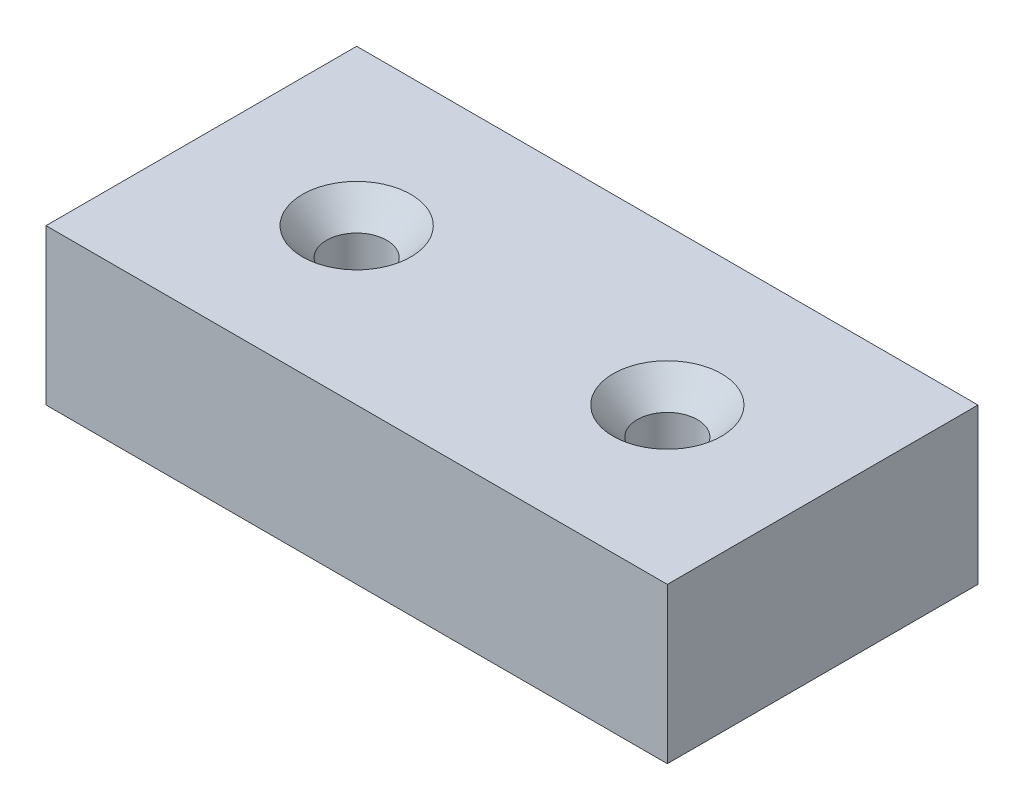
from build123d import *
from OCP.BRepFilletAPI import BRepFilletAPI_MakeChamfer

# Parameters (mm, degrees)
SKETCH1_W           = 50.8
SKETCH1_H           = 25.4
BOSS_EXTRUDE1_DEPTH = 12.7
HOLE1_D             = 4.9276
CHAMFER1_SIZE       = 1.9685
CHAMFER1_SIZE2      = 2.264500221


with BuildPart() as part:
    # Sketch1 → Boss-Extrude1 (new body)
    with BuildSketch(Plane(origin=(0, 6.35, 0), x_dir=(1, 0, 0), z_dir=(0, 1, 0))):
        Rectangle(SKETCH1_W, SKETCH1_H)
    extrude(amount=-BOSS_EXTRUDE1_DEPTH)

    # Hole1 (through all)
    with Locations(Plane(origin=(0, 6.35, 0), x_dir=(1, 0, 0), z_dir=(0, 1, 0))):
        with Locations((-12.7, 0), (12.7, 0)):
            Hole(HOLE1_D / 2)

    # Chamfer1: one chamfer whose edges measure the first distance from different faces: ONE call of the kernel's chamfer builder (chamfer() names one face for all edges)
    chamfer1_edges_1 = [part.edges().sort_by_distance(p)[0] for p in [
        (15.1638, 6.35, 0),
        (-10.2362, 6.35, 0),
    ]]
    chamfer1_side_1 = [part.faces().sort_by_distance(p)[0] for p in [
        (0, 6.35, 0),
    ]]
    chamfer1_edges_2 = [part.edges().sort_by_distance(p)[0] for p in [
        (15.1638, -6.35, 0),
    ]]
    chamfer1_side_2 = [part.faces().sort_by_distance(p)[0] for p in [
        (15.1638, 0, 0),
    ]]
    chamfer1_edges_3 = [part.edges().sort_by_distance(p)[0] for p in [
        (-10.2362, -6.35, 0),
    ]]
    chamfer1_side_3 = [part.faces().sort_by_distance(p)[0] for p in [
        (-10.2362, 0, 0),
    ]]
    chamfer1 = BRepFilletAPI_MakeChamfer(part.part.solid().wrapped)
    for e in chamfer1_edges_1:
        chamfer1.Add(CHAMFER1_SIZE, CHAMFER1_SIZE2, e.wrapped, chamfer1_side_1[0].wrapped)  # the first distance lies on this face
    for e in chamfer1_edges_2:
        chamfer1.Add(CHAMFER1_SIZE, CHAMFER1_SIZE2, e.wrapped, chamfer1_side_2[0].wrapped)  # the first distance lies on this face
    for e in chamfer1_edges_3:
        chamfer1.Add(CHAMFER1_SIZE, CHAMFER1_SIZE2, e.wrapped, chamfer1_side_3[0].wrapped)  # the first distance lies on this face
    add(Compound.cast(chamfer1.Shape()), mode=Mode.REPLACE)


solid = part.part
